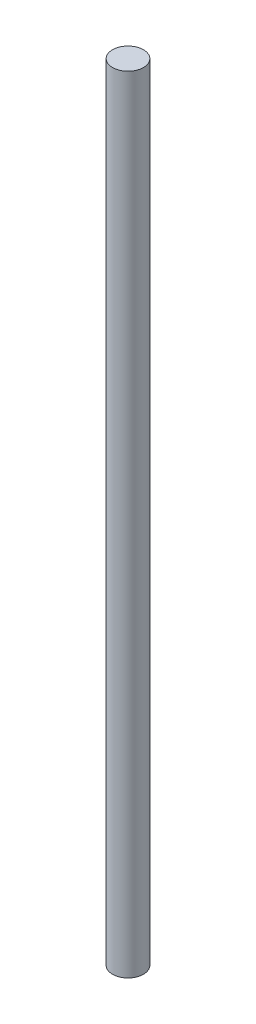
from build123d import *

# Parameters (mm, degrees)
SKETCH1_R           = 5
BOSS_EXTRUDE1_DEPTH = 254


with BuildPart() as part:
    # Sketch1 → Boss-Extrude1 (new body)
    with BuildSketch(Plane(origin=(0, 0, 0), x_dir=(1, 0, 0), z_dir=(0, 1, 0))):
        with Locations(Location((0, 0, 0), (0, 0, 270))):
            Circle(SKETCH1_R)
    extrude(amount=BOSS_EXTRUDE1_DEPTH)


solid = part.part
